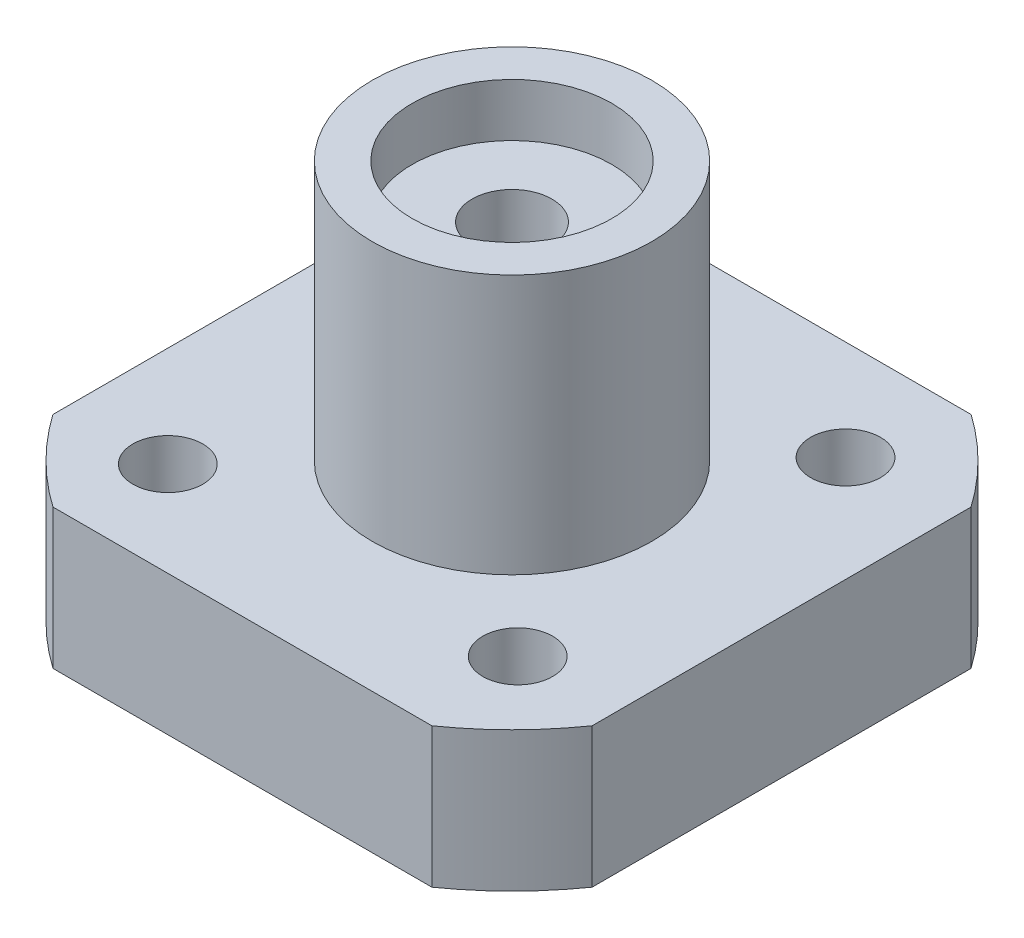
from build123d import *

# Parameters (mm, degrees)
EXTRUDE_1_DEPTH           = 7
SKETCH_6_R                = 7
EXTRUDE_5_DEPTH           = 13
SKETCH_8_R                = 2
CUT_EXTRUDE_2_DEPTH       = 30
SKETCH_9_R                = 5
CUT_EXTRUDE_3_DEPTH       = 2.65
CUT_EXTRUDE_START         = -2.65
SKETCH_10_R               = 5
CUT_EXTRUDE_4_DEPTH       = 2.65
HOLE_WIZARD_2_D           = 3.5
HOLE_WIZARD_2_DEPTH       = 20
HOLE_WIZARD_2_CBORE_D     = 6.5
HOLE_WIZARD_2_CBORE_DEPTH = 3.1
HOLE_WIZARD_2_TIP         = 1.051506083


with BuildPart() as part:
    # 草图1 → 凸台-拉伸1 (new body)
    with BuildSketch(Plane(origin=(0, 0, 0), x_dir=(1, 0, 0), z_dir=(0, 1, 0))):
        with BuildLine():
            Line((9.486832981, -13.5), (-9.486832981, -13.5))
            ThreePointArc((-9.486832981, -13.5), (-11.66726189, -11.66726189), (-13.5, -9.486832981))
            Line((-13.5, -9.486832981), (-13.5, 9.486832981))
            ThreePointArc((-13.5, 9.486832981), (-11.66726189, 11.66726189), (-9.486832981, 13.5))
            Line((-9.486832981, 13.5), (9.486832981, 13.5))
            ThreePointArc((9.486832981, 13.5), (11.66726189, 11.66726189), (13.5, 9.486832981))
            Line((13.5, 9.486832981), (13.5, -9.486832981))
            ThreePointArc((13.5, -9.486832981), (11.66726189, -11.66726189), (9.486832981, -13.5))
        make_face()
    extrude(amount=EXTRUDE_1_DEPTH)

    # 草图6 → 凸台-拉伸5 (add)
    with BuildSketch(Plane(origin=(0, 7, 0), x_dir=(1, 0, 0), z_dir=(0, 1, 0))):
        with Locations(Location((0, 0, 0), (0, 0, 90))):
            Circle(SKETCH_6_R)
    extrude(amount=EXTRUDE_5_DEPTH)

    # 草图8 → 切除-拉伸2 (cut)
    with BuildSketch(Plane(origin=(0, 20, 0), x_dir=(1, 0, 0), z_dir=(0, 1, 0))):
        with Locations(Location((0, 0, 0), (0, 0, 270))):
            Circle(SKETCH_8_R)
    extrude(amount=-CUT_EXTRUDE_2_DEPTH, mode=Mode.SUBTRACT)

    # 草图9 → 切除-拉伸3 (cut)
    with BuildSketch(Plane(origin=(0, 20, 0), x_dir=(1, 0, 0), z_dir=(0, 1, 0))):
        with Locations(Location((0, 0, 0), (0, 0, 270))):
            Circle(SKETCH_9_R)
    extrude(amount=-CUT_EXTRUDE_3_DEPTH, mode=Mode.SUBTRACT)

    # 草图10 → 切除-拉伸4 (cut)
    with BuildSketch(Plane.XZ.offset(CUT_EXTRUDE_START)):
        with Locations(Location((0, 0, 0), (0, 0, 90))):
            Circle(SKETCH_10_R)
    extrude(amount=CUT_EXTRUDE_4_DEPTH, mode=Mode.SUBTRACT)

    # 孔2
    with Locations(Plane(origin=(0, 0, 0), x_dir=(-1, 0, 0), z_dir=(0, -1, 0))):
        with Locations((-8.209852454, 8.492066132), (8.626364404, 8.339687642), (8.471576116, -8.762786544), (-8.626364404, -8.339687642)):
            CounterBoreHole(HOLE_WIZARD_2_D / 2, HOLE_WIZARD_2_CBORE_D / 2, HOLE_WIZARD_2_CBORE_DEPTH, depth=HOLE_WIZARD_2_DEPTH)
            with Locations((0, 0, -(HOLE_WIZARD_2_DEPTH + HOLE_WIZARD_2_TIP / 2))):  # 118° drill point
                Cone(0, HOLE_WIZARD_2_D / 2, HOLE_WIZARD_2_TIP, mode=Mode.SUBTRACT)


solid = part.part
